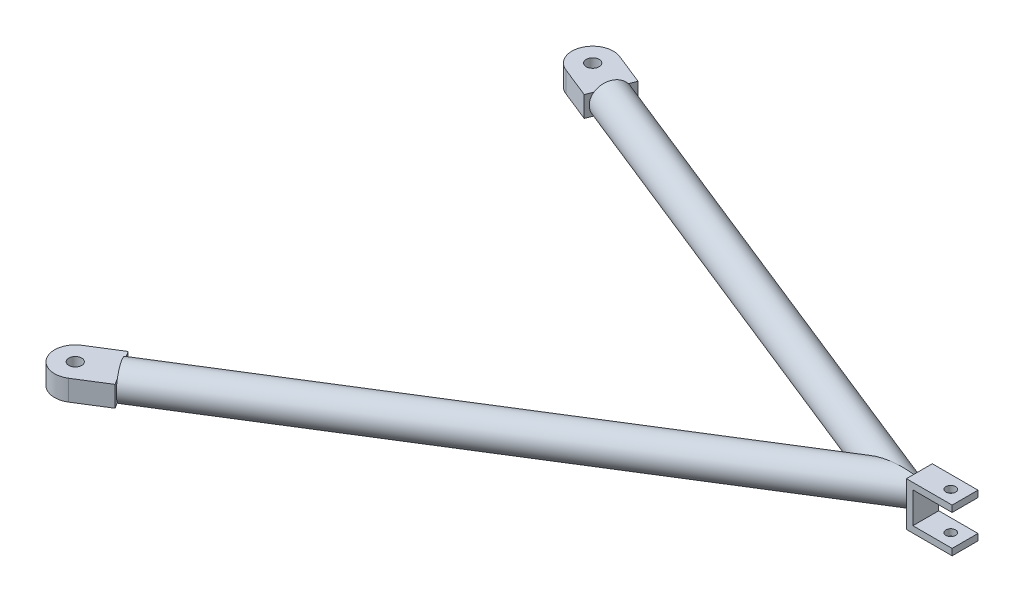
from build123d import *

# Parameters (mm, degrees)
SKETCH2_R                      = 8.255
BOSS_EXTRUDE1_DEPTH            = 6.35
BOSS_EXTRUDE1_DEPTH_BACK       = 6.35
BOSS_EXTRUDE2_DEPTH            = 10.16
BOSS_EXTRUDE2_DEPTH_BACK       = 16.51
SKETCH4_W                      = 20.32
SKETCH4_H                      = 10.16
BOSS_EXTRUDE3_DEPTH            = 10.16
BOSS_EXTRUDE3_DEPTH_BACK       = 16.256
SKETCH5_W                      = 20.32
SKETCH5_H                      = 10.16
CUT_EXTRUDE1_DEPTH             = 312.833197041
CUT_EXTRUDE2_DEPTH             = 312.833197041
CUT_EXTRUDE3_DEPTH             = 16.51
CUT_EXTRUDE4_START             = -16.256
CUT_EXTRUDE4_DEPTH             = 16.256
CUT_EXTRUDE5_DEPTH             = 303.933951477
E_0_25_DIAMETER_HOLE1_D        = 6.35
E_0_25_DIAMETER_HOLE1_DEPTH    = 19.05
E_0_25_DIAMETER_HOLE1_TIP      = 1.907732465
F_3_16_0_1875_DIAMETER_HOLE1_D = 4.7625


with BuildPart() as part:
    # Sweep1: sweep along a path in Sketch1
    with BuildLine(Plane(origin=(0, 0, 0), x_dir=(1, 0, 0), z_dir=(0, 1, 0))) as sweep1_path:
        Line((-247.620690573, 99.06), (0, 0))
        Line((0, 0), (-247.620690573, -154.94))
    # Sketch2 → Sweep1 (sweep)
    with BuildSketch(Plane(origin=(-247.620690573, 0, 154.94), x_dir=(0.5304347826086957, 0, 0.847725746570709), z_dir=(-0.8477257465707089, 0, 0.5304347826086956))):
        Circle(SKETCH2_R)
    sweep(path=sweep1_path.line, transition=Transition.RIGHT)

    # Sketch3 → Boss-Extrude1 (add, two sides: drawn at the far end of the back side and taken through both)
    with BuildSketch(Plane.XY.offset(-BOSS_EXTRUDE1_DEPTH_BACK)):
        Polygon((34.256672931, -10.795), (11.811, -10.795), (11.811, 10.795), (34.256672931, 10.795), (34.256672931, 7.62), (14.986, 7.62), (14.986, -7.62), (34.256672931, -7.62), align=None)
    extrude(amount=BOSS_EXTRUDE1_DEPTH + BOSS_EXTRUDE1_DEPTH_BACK)

    # Sketch4 → Boss-Extrude2 (add, two sides: drawn at the far end of the back side and taken through both)
    with BuildSketch(Plane(origin=(-247.620690573, 0, 154.94), x_dir=(0.5304347826086958, 0, 0.8477257465707089), z_dir=(-0.847725746570709, 0, 0.5304347826086958)).offset(-BOSS_EXTRUDE2_DEPTH_BACK)):
        Rectangle(SKETCH4_W, SKETCH4_H)
    extrude(amount=BOSS_EXTRUDE2_DEPTH + BOSS_EXTRUDE2_DEPTH_BACK)

    # Sketch5 → Boss-Extrude3 (add, two sides: drawn at the far end of the back side and taken through both)
    with BuildSketch(Plane(origin=(-247.620690573, 0, -99.06), x_dir=(-0.3714285714285716, 0, 0.9284615319583954), z_dir=(-0.9284615319583954, 0, -0.3714285714285716)).offset(-BOSS_EXTRUDE3_DEPTH_BACK)):
        Rectangle(SKETCH5_W, SKETCH5_H)
    extrude(amount=BOSS_EXTRUDE3_DEPTH + BOSS_EXTRUDE3_DEPTH_BACK)

    # Sketch7 → Cut-Extrude1 (cut, through all)
    with BuildSketch(Plane(origin=(0, 5.08, 0), x_dir=(1, 0, 0), z_dir=(0, 1, 0))):
        with BuildLine():
            Line((-257.053859738, 102.833714286), (-260.827574024, 93.400545121))
            Line((-260.827574024, 93.400545121), (-251.394404859, 89.626830835))
            ThreePointArc((-251.394404859, 89.626830835), (-256.959367419, 95.058161077), (-257.053859738, 102.833714286))
        make_face()
    cut_extrude1 = extrude(amount=-CUT_EXTRUDE1_DEPTH, mode=Mode.SUBTRACT)

    # Mirror1: Cut-Extrude1 across plane
    add(cut_extrude1.mirror(Plane(origin=(0, 0, 0), x_dir=(0.9284615319583953, 0, 0.3714285714285718), z_dir=(-0.3714285714285718, 0, 0.9284615319583954))), mode=Mode.SUBTRACT)

    # Sketch9 → Cut-Extrude2 (cut, through all)
    with BuildSketch(Plane(origin=(0, 5.08, 0), x_dir=(1, 0, 0), z_dir=(0, 1, 0))):
        with BuildLine():
            Line((-242.231473182, -163.552893585), (-250.844366767, -168.942110976))
            Line((-250.844366767, -168.942110976), (-256.233584158, -160.329217391))
            ThreePointArc((-256.233584158, -160.329217391), (-249.90017387, -164.840987622), (-242.231473182, -163.552893585))
        make_face()
    cut_extrude2 = extrude(amount=-CUT_EXTRUDE2_DEPTH, mode=Mode.SUBTRACT)

    # Mirror2: Cut-Extrude2 across plane
    add(cut_extrude2.mirror(Plane(origin=(0, 0, 0), x_dir=(-0.8477257465707089, 0, 0.5304347826086955), z_dir=(0.5304347826086959, 0, 0.8477257465707089))), mode=Mode.SUBTRACT)

    # Sketch10 → Cut-Extrude3 (cut)
    with BuildSketch(Plane(origin=(-247.620690573, 0, 154.94), x_dir=(0.5304347826086958, 0, 0.8477257465707089), z_dir=(-0.847725746570709, 0, 0.5304347826086958))):
        with BuildLine():
            Line((6.506813736, -5.08), (-6.506813736, -5.08))
            ThreePointArc((-6.506813736, -5.08), (0, -8.255), (6.506813736, -5.08))
        make_face()
        with BuildLine():
            Line((-6.506813736, 5.08), (6.506813736, 5.08))
            ThreePointArc((6.506813736, 5.08), (0, 8.255), (-6.506813736, 5.08))
        make_face()
    extrude(amount=-CUT_EXTRUDE3_DEPTH, mode=Mode.SUBTRACT)

    # Sketch11 → Cut-Extrude4 (cut)
    with BuildSketch(Plane(origin=(-247.620690573, 0, -99.06), x_dir=(-0.3714285714285716, 0, 0.9284615319583954), z_dir=(-0.9284615319583954, 0, -0.3714285714285716)).offset(CUT_EXTRUDE4_START)):
        with BuildLine():
            Line((6.506813736, -5.08), (-6.506813736, -5.08))
            ThreePointArc((-6.506813736, -5.08), (0, -8.255), (6.506813736, -5.08))
        make_face()
        with BuildLine():
            Line((-6.506813736, 5.08), (6.506813736, 5.08))
            ThreePointArc((6.506813736, 5.08), (0, 8.255), (-6.506813736, 5.08))
        make_face()
    extrude(amount=CUT_EXTRUDE4_DEPTH, mode=Mode.SUBTRACT)

    # Sketch12 → Cut-Extrude5 (cut, through all)
    with BuildSketch(Plane.XY.offset(6.35)):
        with BuildLine():
            Line((14.986, 4.663063163), (14.986, -4.663063163))
            add(Edge.make_bspline(
                [(14.986, -4.663063163), (22.008669492, 0), (14.986, 4.663063163)],
                knots=[5.682900603, 5.682900603, 5.682900603, 6.883470012, 6.883470012, 6.883470012], degree=2, weights=[1, 0.825174825, 1]))
        make_face()
    extrude(amount=-CUT_EXTRUDE5_DEPTH, mode=Mode.SUBTRACT)

    # E (0.25) Diameter Hole1
    with Locations(Plane(origin=(-247.620690573, 5.08, -99.06), x_dir=(0, 0, 1), z_dir=(0, 1, 0))):
        with Locations((0, 0), (254, 0)):
            Hole(E_0_25_DIAMETER_HOLE1_D / 2, depth=E_0_25_DIAMETER_HOLE1_DEPTH)
            with Locations((0, 0, -(E_0_25_DIAMETER_HOLE1_DEPTH + E_0_25_DIAMETER_HOLE1_TIP / 2))):  # 118° drill point
                Cone(0, E_0_25_DIAMETER_HOLE1_D / 2, E_0_25_DIAMETER_HOLE1_TIP, mode=Mode.SUBTRACT)

    # 3/16 (0.1875) Diameter Hole1 (through all)
    with Locations(Plane(origin=(0, 10.795, 0), x_dir=(1, 0, 0), z_dir=(0, 1, 0))):
        with Locations((27.241523324, 0)):
            Hole(F_3_16_0_1875_DIAMETER_HOLE1_D / 2)


solid = part.part
